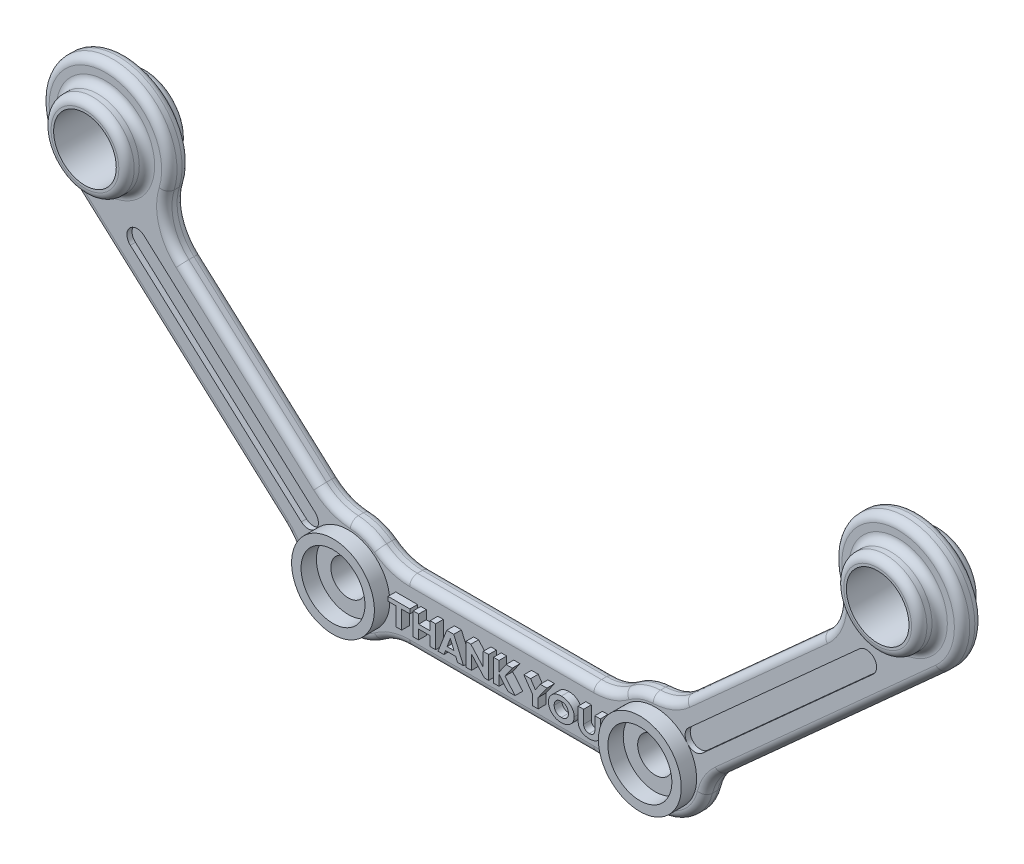
from build123d import *

# Parameters (mm, degrees)
SKETCH1_R                = 6.25
SKETCH1_R_2              = 3.429
BOSS_EXTRUDE1_DEPTH      = 2
BOSS_EXTRUDE5_DEPTH      = 4
BOSS_EXTRUDE5_DEPTH_BACK = 8
SKETCH7_R                = 8.125
SKETCH7_R_2              = 6.125
THANK_YOU_DEPTH          = 1.5
BOSS_EXTRUDE7_DEPTH      = 1.5
CUT_EXTRUDE3_DEPTH       = 1
FILLET1_R                = 10
FILLET2_R                = 1.5
SKETCH15_R               = 8.1
SKETCH15_R_2             = 6.25
BOSS_EXTRUDE8_DEPTH      = 3


with BuildPart() as part:
    # Sketch1 → Boss-Extrude1 (new, symmetric)
    with BuildSketch(Plane.XY):
        with BuildLine():
            Line((85.864132579, -9.289310318), (39.997743892, -50.58759219))
            ThreePointArc((39.997743892, -50.58759219), (33.262858848, -60.252711364), (22, -56.8))
            Line((22, -56.8), (-22, -56.8))
            ThreePointArc((-22, -56.8), (-33.262858848, -60.252711364), (-39.997743892, -50.58759219))
            Line((-39.997743892, -50.58759219), (-85.864132579, -9.289310318))
            ThreePointArc((-85.864132579, -9.289310318), (-77.904361198, 12.493457969), (-68.552689408, -8.729011007))
            Line((-68.552689408, -8.729011007), (-32.563210837, -41.134083065))
            ThreePointArc((-32.563210837, -41.134083065), (-26.721371347, -41.35274674), (-22, -44.8))
            Line((-22, -44.8), (22, -44.8))
            ThreePointArc((22, -44.8), (26.721371347, -41.35274674), (32.563210837, -41.134083065))
            Line((32.563210837, -41.134083065), (68.552689408, -8.729011007))
            ThreePointArc((68.552689408, -8.729011007), (77.904361198, 12.493457969), (85.864132579, -9.289310318))
        make_face()
        with Locations((-77.5, 0)):
            Circle(SKETCH1_R, mode=Mode.SUBTRACT)
        with Locations((77.5, 0)):
            Circle(SKETCH1_R, mode=Mode.SUBTRACT)
        with Locations((30, -50.8)):
            Circle(SKETCH1_R_2, mode=Mode.SUBTRACT)
        with Locations((-30, -50.8)):
            Circle(SKETCH1_R_2, mode=Mode.SUBTRACT)
    extrude(amount=BOSS_EXTRUDE1_DEPTH, both=True)

    # Sketch7 → Boss-Extrude5 (add, two sides: drawn at the far end of the back side and taken through both)
    # profile 1 of 2: a face of its own
    with BuildSketch(Plane.XY.offset(2).offset(-BOSS_EXTRUDE5_DEPTH_BACK)):
        with Locations((-77.5, 0)):
            Circle(SKETCH7_R)
        with Locations((-77.5, 0)):
            Circle(SKETCH7_R_2, mode=Mode.SUBTRACT)
    # profile 2 of 2: a face of its own
    with BuildSketch(Plane.XY.offset(2).offset(-BOSS_EXTRUDE5_DEPTH_BACK)):
        with Locations((77.5, 0)):
            Circle(SKETCH7_R)
        with Locations(Location((77.5, 0, 0), (0, 0, 180))):
            Circle(SKETCH7_R_2, mode=Mode.SUBTRACT)
    extrude(amount=BOSS_EXTRUDE5_DEPTH + BOSS_EXTRUDE5_DEPTH_BACK)

    # Sketch3 → Thank You (add)
    # profile 1 of 8: a face of its own
    with BuildSketch(Plane.XY.offset(2)):
        Polygon((-16.472466218, -48.577487684), (-16.472466218, -49.40752292), (-18.073248458, -49.40752292), (-18.073248458, -52.964816786), (-19.140436618, -52.964816786), (-19.140436618, -49.40752292), (-20.741218858, -49.40752292), (-20.741218858, -48.577487684), align=None)
    # profile 2 of 8: a face of its own
    with BuildSketch(Plane.XY.offset(2)):
        Polygon((-11.432966575, -48.577487684), (-11.432966575, -52.964816786), (-12.500154735, -52.964816786), (-12.500154735, -51.126881622), (-14.753107516, -51.126881622), (-14.753107516, -52.964816786), (-15.820295676, -52.964816786), (-15.820295676, -48.577487684), (-14.753107516, -48.577487684), (-14.753107516, -50.296846386), (-12.500154735, -50.296846386), (-12.500154735, -48.577487684), align=None)
    # profile 3 of 8: a face of its own
    with BuildSketch(Plane.XY.offset(2)):
        Polygon((-7.890494766, -48.577487684), (-5.978449313, -52.964816786), (-7.149391878, -52.964816786), (-7.498636614, -52.134781551), (-9.496835278, -52.134781551), (-9.807172112, -52.964816786), (-10.958660726, -52.964816786), (-9.255976839, -48.577487684), align=None)
        Polygon((-7.848807729, -51.304746315), (-8.557487366, -49.621516379), (-9.186498443, -51.304746315), align=None, mode=Mode.SUBTRACT)
    # profile 4 of 8: a face of its own
    with BuildSketch(Plane.XY.offset(2)):
        Polygon((-1.057526132, -48.577487684), (-1.057526132, -52.964816786), (-1.902383425, -52.964816786), (-4.436955305, -50.15418408), (-4.436955305, -52.964816786), (-5.504143464, -52.964816786), (-5.504143464, -48.577487684), (-4.544415223, -48.577487684), (-2.124714292, -51.259353763), (-2.124714292, -48.577487684), align=None)
    # profile 5 of 8: a face of its own
    with BuildSketch(Plane.XY.offset(2)):
        Polygon((3.566955894, -48.577487684), (2.126437154, -50.649796637), (4.100549974, -52.964816786), (2.705423786, -52.964816786), (0.958273726, -50.916593677), (0.958273726, -52.964816786), (-0.108914434, -52.964816786), (-0.108914434, -48.577487684), (0.958273726, -48.577487684), (0.958273726, -50.563643426), (2.339504235, -48.577487684), align=None)
    # profile 6 of 8: a face of its own
    with BuildSketch(Plane.XY.offset(2)):
        Polygon((7.539267378, -52.964816786), (7.539267378, -51.062961498), (5.819908676, -48.577487684), (7.141850954, -48.577487684), (8.072861458, -50.000405231), (9.02517867, -48.577487684), (10.32581424, -48.577487684), (8.606455538, -51.038875654), (8.606455538, -52.964816786), align=None)
    # profile 7 of 8: a face of its own
    with BuildSketch(Plane.XY.offset(2)):
        with BuildLine():
            add(Edge.make_bspline(
                [(13.144784353, -48.518199453), (13.236294357, -48.519894148), (13.415594504, -48.523214648), (13.677423582, -48.556921101), (13.926308985, -48.608997867), (14.161870705, -48.683400223), (14.384378601, -48.778812525), (14.592748838, -48.896341645), (14.78824804, -49.034179586), (14.966606287, -49.193064558), (15.128901299, -49.364260074), (15.271744927, -49.544210791), (15.391607319, -49.732294879), (15.490803594, -49.926524449), (15.567176994, -50.128226102), (15.622109885, -50.336772476), (15.655256716, -50.552700603), (15.659574731, -50.699088766), (15.661755039, -50.773004992)],
                knots=[0, 0, 0, 0, 1.165622065, 2.283861866, 3.358235241, 4.402427472, 5.426561762, 6.437930106, 7.445716825, 8.468935895, 9.47662273, 10.448902879, 11.392078326, 12.314266974, 13.223459075, 14.135007119, 15.058303401, 16, 16, 16, 16], degree=3))
            add(Edge.make_bspline(
                [(15.661755039, -50.773004992), (15.659688598, -50.847862328), (15.655603002, -50.995864098), (15.620979108, -51.213474018), (15.566269714, -51.423729699), (15.489409584, -51.626678515), (15.388051887, -51.82103416), (15.265986918, -52.008010374), (15.122361617, -52.187896851), (14.957798295, -52.357343507), (14.776509848, -52.513743735), (14.580073699, -52.650169186), (14.372033041, -52.767002245), (14.150546453, -52.860640169), (13.91692309, -52.934003503), (13.670708813, -52.986484972), (13.411825933, -53.01878621), (13.235047795, -53.022307193), (13.144784353, -53.024105017)],
                knots=[0, 0, 0, 0, 0.954451227, 1.887062486, 2.803341652, 3.722216646, 4.648927594, 5.594017305, 6.566642212, 7.580671446, 8.603112717, 9.616100853, 10.626566014, 11.641390661, 12.67793981, 13.745695611, 14.848945495, 16, 16, 16, 16], degree=3))
            add(Edge.make_bspline(
                [(13.144784353, -53.024105017), (13.053589102, -53.022346018), (12.87526039, -53.018906366), (12.614367062, -52.986175421), (12.366089885, -52.935154786), (12.130884686, -52.861821593), (11.908864956, -52.767521961), (11.699342052, -52.65372158), (11.503513406, -52.517071514), (11.322807622, -52.361378704), (11.158614075, -52.192165324), (11.015283911, -52.012841249), (10.89359653, -51.825718532), (10.795113913, -51.630098376), (10.717783977, -51.427082901), (10.661560049, -51.216467641), (10.628738295, -50.997298424), (10.624436308, -50.848459562), (10.622255395, -50.773004992)],
                knots=[0, 0, 0, 0, 1.159962874, 2.26826159, 3.340224557, 4.381686788, 5.397595826, 6.405180259, 7.410171676, 8.430062382, 9.43600586, 10.406204473, 11.346796863, 12.271120889, 13.187703674, 14.106498895, 15.040080603, 16, 16, 16, 16], degree=3))
            add(Edge.make_bspline(
                [(10.622255395, -50.773004992), (10.624424696, -50.698779902), (10.62871207, -50.552082515), (10.661872575, -50.335836413), (10.717012556, -50.127055755), (10.79302972, -49.924927287), (10.892283606, -49.730162587), (11.013314581, -49.54262752), (11.156038728, -49.362443023), (11.318086906, -49.190888544), (11.497981223, -49.033306852), (11.693847851, -48.895585823), (11.902432415, -48.777964384), (12.12498903, -48.682025346), (12.36161783, -48.609314735), (12.61089824, -48.5569203), (12.873360103, -48.523185767), (13.052966756, -48.519886227), (13.144784353, -48.518199453)],
                knots=[0, 0, 0, 0, 0.944229995, 1.866162393, 2.776363907, 3.6878876, 4.608714001, 5.552616899, 6.523460805, 7.529659095, 8.5517293, 9.561236656, 10.571111016, 11.593732465, 12.638955724, 13.71558515, 14.832173099, 16, 16, 16, 16], degree=3))
        make_face()
        with BuildLine():
            add(Edge.make_bspline(
                [(13.144784353, -52.134781551), (13.195787595, -52.133828025), (13.295642992, -52.131961189), (13.44138786, -52.114035696), (13.579471885, -52.084586035), (13.709701605, -52.042668535), (13.832530612, -51.989621008), (13.948523226, -51.925968057), (14.055204743, -51.848052857), (14.154103609, -51.760215816), (14.244279155, -51.663370832), (14.321919277, -51.557309949), (14.388712905, -51.444316115), (14.442080308, -51.323511552), (14.484246109, -51.195704858), (14.513213483, -51.060584065), (14.532803524, -50.918401811), (14.534441816, -50.820936884), (14.535278648, -50.771152235)],
                knots=[0, 0, 0, 0, 1.115777621, 2.184496794, 3.207765851, 4.201533405, 5.17318039, 6.132148444, 7.090568687, 8.057527786, 9.023541851, 9.980483822, 10.928555928, 11.890543238, 12.865029621, 13.868492252, 14.91123537, 16, 16, 16, 16], degree=3))
            add(Edge.make_bspline(
                [(14.535278648, -50.771152235), (14.53446145, -50.721056496), (14.532866421, -50.623278293), (14.513091951, -50.480511746), (14.484396434, -50.345023547), (14.442077066, -50.21693471), (14.388672536, -50.096166774), (14.322208116, -49.983238182), (14.24396708, -49.877920246), (14.154091147, -49.781210622), (14.055532059, -49.69315728), (13.947948748, -49.616616905), (13.832830213, -49.551580715), (13.709832611, -49.498531193), (13.579294179, -49.457990206), (13.441412244, -49.428186274), (13.295636467, -49.410365359), (13.195785389, -49.40848391), (13.144784353, -49.40752292)],
                knots=[0, 0, 0, 0, 1.095159192, 2.137560986, 3.147293072, 4.121460472, 5.083132892, 6.030894661, 6.982093191, 7.947791046, 8.914433627, 9.868602264, 10.830559385, 11.801888316, 12.79328416, 13.816218266, 14.884587611, 16, 16, 16, 16], degree=3))
            add(Edge.make_bspline(
                [(13.144784353, -49.40752292), (13.093783149, -49.408491946), (12.993625071, -49.410394956), (12.84724917, -49.428222803), (12.708681105, -49.457808847), (12.577678372, -49.498772334), (12.454136616, -49.551291821), (12.33871232, -49.616893288), (12.230368458, -49.693132074), (12.130891851, -49.780922492), (12.040993699, -49.877949567), (11.962741977, -49.983236935), (11.896187232, -50.096142707), (11.843122069, -50.217123754), (11.799320424, -50.34482398), (11.771006266, -50.480540908), (11.751120461, -50.623270468), (11.749541005, -50.721053845), (11.748731786, -50.771152235)],
                knots=[0, 0, 0, 0, 1.113170971, 2.186086936, 3.213556208, 4.202959844, 5.178530162, 6.138554233, 7.096302912, 8.066055017, 9.029812305, 9.979099404, 10.924956649, 11.884696591, 12.859031405, 13.866734437, 14.907041527, 16, 16, 16, 16], degree=3))
            add(Edge.make_bspline(
                [(11.748731786, -50.771152235), (11.749560709, -50.820939512), (11.751183518, -50.918409582), (11.770884535, -51.060554971), (11.799473201, -51.19590363), (11.843119085, -51.323322409), (11.89614681, -51.444340199), (11.963030977, -51.557311158), (12.040681685, -51.663341347), (12.130880055, -51.760503731), (12.230695369, -51.84807493), (12.338139132, -51.925693806), (12.454437208, -51.989907487), (12.577810163, -52.042425278), (12.708502782, -52.084769389), (12.847273778, -52.113998447), (12.993618534, -52.131931622), (13.093780944, -52.133819983), (13.144784353, -52.134781551)],
                knots=[0, 0, 0, 0, 1.086577571, 2.127226078, 3.128673001, 4.10332758, 5.063382497, 6.00955016, 6.964569872, 7.928643454, 8.898713819, 9.860685606, 10.817727331, 11.793617821, 12.785389142, 13.813195616, 14.8864637, 16, 16, 16, 16], degree=3))
        make_face(mode=Mode.SUBTRACT)
    # profile 8 of 8: a face of its own
    with BuildSketch(Plane.XY.offset(2)):
        with BuildLine():
            Line((19.693354754, -48.577487684), (20.760542914, -48.577487684))
            Line((20.760542914, -48.577487684), (20.760542914, -51.069446148))
            add(Edge.make_bspline(
                [(20.760542914, -51.069446148), (20.75922476, -51.147351444), (20.756663651, -51.298717602), (20.728783294, -51.518107859), (20.686063278, -51.723029619), (20.625040102, -51.913771453), (20.544650018, -52.08956632), (20.448636108, -52.252062368), (20.333197622, -52.398846689), (20.20099351, -52.530546911), (20.053279988, -52.648318508), (19.888329341, -52.747884484), (19.710470158, -52.834767258), (19.51639304, -52.903952265), (19.30819134, -52.95877327), (19.084483626, -52.995283005), (18.846616684, -53.020825999), (18.682749446, -53.022990519), (18.598375236, -53.024105017)],
                knots=[0, 0, 0, 0, 1.124048165, 2.183970302, 3.186786779, 4.142558732, 5.068176859, 5.971797666, 6.860853538, 7.756034682, 8.660369888, 9.580853754, 10.531842363, 11.513278426, 12.550162722, 13.635501559, 14.782534621, 16, 16, 16, 16], degree=3))
            add(Edge.make_bspline(
                [(18.598375236, -53.024105017), (18.514930441, -53.022961408), (18.352610154, -53.020736813), (18.116500367, -52.995468429), (17.894066369, -52.957832961), (17.686235716, -52.901876922), (17.492350565, -52.831869778), (17.312915276, -52.745411472), (17.148540244, -52.642184162), (16.998542108, -52.524187049), (16.864364054, -52.391783863), (16.748929051, -52.243676732), (16.649786761, -52.082825742), (16.570349885, -51.907293964), (16.50804654, -51.71879985), (16.463742683, -51.516756198), (16.437956109, -51.300783175), (16.434353821, -51.152273241), (16.432502043, -51.075930798)],
                knots=[0, 0, 0, 0, 1.207858031, 2.349575711, 3.434661095, 4.471606332, 5.461837986, 6.415796098, 7.350025858, 8.266973576, 9.174441136, 10.072551113, 10.979798307, 11.904238528, 12.855888234, 13.849677442, 14.894613485, 16, 16, 16, 16], degree=3))
            Line((16.432502043, -51.075930798), (16.432502043, -48.577487684))
            Line((16.432502043, -48.577487684), (17.499690203, -48.577487684))
            Line((17.499690203, -48.577487684), (17.499690203, -51.116691457))
            add(Edge.make_bspline(
                [(17.499690203, -51.116691457), (17.500546553, -51.154101623), (17.502229994, -51.227643849), (17.516420796, -51.334943981), (17.539102943, -51.437008453), (17.573227399, -51.53249877), (17.61418198, -51.623379126), (17.667462053, -51.706829372), (17.727151195, -51.786528385), (17.797927343, -51.858175615), (17.875569177, -51.922916683), (17.959530706, -51.979957957), (18.049289058, -52.028016263), (18.144943616, -52.067192648), (18.246287501, -52.098053417), (18.353767215, -52.118637283), (18.466797162, -52.132144427), (18.543986855, -52.133887881), (18.583553178, -52.134781551)],
                knots=[0, 0, 0, 0, 1.071513455, 2.10641899, 3.095885275, 4.061283482, 5.007391847, 5.945272666, 6.892042761, 7.855614675, 8.823078514, 9.785064836, 10.758860075, 11.734863606, 12.742518403, 13.788858874, 14.866600946, 16, 16, 16, 16], degree=3))
            add(Edge.make_bspline(
                [(18.583553178, -52.134781551), (18.624656695, -52.133853669), (18.704912361, -52.132041956), (18.822087271, -52.119046164), (18.932890838, -52.09710932), (19.037162222, -52.065065009), (19.135768151, -52.025973524), (19.227101908, -51.975850943), (19.313019861, -51.918625511), (19.391686845, -51.851558842), (19.463279748, -51.777022884), (19.524720434, -51.693631379), (19.57690036, -51.603201762), (19.619586434, -51.505280422), (19.653015439, -51.399721102), (19.676888348, -51.286808212), (19.690872116, -51.166142647), (19.692510453, -51.083379586), (19.693354754, -51.040728411)],
                knots=[0, 0, 0, 0, 1.116708024, 2.180400969, 3.19895919, 4.181027281, 5.140799512, 6.075601644, 7.006441693, 7.941093197, 8.878790217, 9.80845728, 10.748216618, 11.710040429, 12.70510482, 13.751717791, 14.841368648, 16, 16, 16, 16], degree=3))
            Line((19.693354754, -51.040728411), (19.693354754, -48.577487684))
        make_face()
    extrude(amount=THANK_YOU_DEPTH)

    # Sketch12 → Boss-Extrude7 (add)
    # profile 1 of 6: a face of its own
    with BuildSketch(Plane(origin=(0, 0, -2), x_dir=(-1, 0, 0), z_dir=(0, 0, -1))):
        with BuildLine():
            Line((-11.88986433, -52.07409444), (-11.88986433, -53.322852807))
            add(Edge.make_bspline(
                [(-11.88986433, -53.322852807), (-11.979949246, -53.368358839), (-12.158649266, -53.458628432), (-12.433701097, -53.574879259), (-12.712319561, -53.672455623), (-12.99387304, -53.753156624), (-13.279069099, -53.814925364), (-13.567379828, -53.859161201), (-13.85897757, -53.887630582), (-14.054643297, -53.890719095), (-14.152698484, -53.89226686)],
                knots=[0, 0, 0, 0, 1.027601516, 2.038436848, 3.0383078, 4.032385978, 5.019284488, 6.007829424, 7.001651131, 8, 8, 8, 8], degree=3))
            add(Edge.make_bspline(
                [(-14.152698484, -53.89226686), (-14.277161087, -53.889812005), (-14.520604802, -53.88501041), (-14.875800439, -53.843030303), (-15.212094869, -53.777446384), (-15.528666153, -53.683455836), (-15.825600105, -53.562246137), (-16.102951394, -53.413085614), (-16.360718559, -53.236958109), (-16.597691075, -53.036270703), (-16.808081057, -52.814100698), (-16.995834931, -52.580579221), (-17.151990262, -52.331889939), (-17.27968118, -52.070868838), (-17.381081667, -51.798075675), (-17.450396087, -51.511536485), (-17.495646357, -51.213389734), (-17.500183914, -51.009956844), (-17.502483541, -50.90685739)],
                knots=[0, 0, 0, 0, 1.186709591, 2.321154991, 3.406265677, 4.451152634, 5.46551681, 6.459952828, 7.448938776, 8.437963703, 9.415627225, 10.36314953, 11.291393777, 12.209893438, 13.13050606, 14.061015161, 15.01732567, 16, 16, 16, 16], degree=3))
            add(Edge.make_bspline(
                [(-17.502483541, -50.90685739), (-17.499832466, -50.803747189), (-17.494598785, -50.600189792), (-17.447119856, -50.301315108), (-17.372091045, -50.013700669), (-17.265278869, -49.738061436), (-17.127094896, -49.474957794), (-16.958793351, -49.224161483), (-16.761413225, -48.984678718), (-16.535004569, -48.760168483), (-16.284522886, -48.554604093), (-16.013146115, -48.374721818), (-15.722643327, -48.223305643), (-15.414338892, -48.09810392), (-15.086589721, -48.001597693), (-14.740303731, -47.935112107), (-14.376149922, -47.891288056), (-14.126892087, -47.886724475), (-13.99953722, -47.884392775)],
                knots=[0, 0, 0, 0, 0.956725153, 1.888741182, 2.802006662, 3.712050624, 4.626778859, 5.55548895, 6.51134318, 7.503316817, 8.51107301, 9.51505965, 10.52040612, 11.547528201, 12.599792297, 13.686794521, 14.818099434, 16, 16, 16, 16], degree=3))
            add(Edge.make_bspline(
                [(-13.99953722, -47.884392775), (-13.897804964, -47.886247632), (-13.697774892, -47.889894727), (-13.403521262, -47.912834178), (-13.121218998, -47.954429146), (-12.850470513, -48.008601291), (-12.592250733, -48.082196944), (-12.346519961, -48.171391232), (-12.110859699, -48.274103797), (-11.963305224, -48.357801311), (-11.88986433, -48.399459283)],
                knots=[0, 0, 0, 0, 1.110924415, 2.184344455, 3.22008277, 4.225247906, 5.197280451, 6.148716305, 7.07857806, 8, 8, 8, 8], degree=3))
            Line((-11.88986433, -48.399459283), (-11.88986433, -49.702565196))
            add(Edge.make_bspline(
                [(-11.88986433, -49.702565196), (-11.977049629, -49.652224515), (-12.147486332, -49.553814579), (-12.406767507, -49.424833723), (-12.662460842, -49.315863488), (-12.915191861, -49.22616263), (-13.164524704, -49.156893736), (-13.410456694, -49.107031287), (-13.652892951, -49.076054084), (-13.813762661, -49.072108488), (-13.893312473, -49.070157397)],
                knots=[0, 0, 0, 0, 1.136155566, 2.221046559, 3.266356359, 4.271718975, 5.245877941, 6.184630589, 7.10230276, 8, 8, 8, 8], degree=3))
            add(Edge.make_bspline(
                [(-13.893312473, -49.070157397), (-13.96914946, -49.071274613), (-14.11754496, -49.073460747), (-14.334234352, -49.099510243), (-14.540572506, -49.138263112), (-14.736511523, -49.194128429), (-14.922149106, -49.265238665), (-15.096495568, -49.353922211), (-15.260311524, -49.458136881), (-15.412605675, -49.577218373), (-15.550522567, -49.708671692), (-15.671335259, -49.850031605), (-15.772937256, -50.000159181), (-15.857298328, -50.158764553), (-15.921111275, -50.32703959), (-15.96650686, -50.503962863), (-15.996469066, -50.688860724), (-15.999150664, -50.815335316), (-16.00051502, -50.879683617)],
                knots=[0, 0, 0, 0, 1.169399512, 2.288245231, 3.362099682, 4.405636331, 5.427192275, 6.424303198, 7.418151308, 8.418171504, 9.40208425, 10.352879019, 11.281344491, 12.193434245, 13.11830754, 14.050416279, 15.008082187, 16, 16, 16, 16], degree=3))
            add(Edge.make_bspline(
                [(-16.00051502, -50.879683617), (-15.999054657, -50.944433838), (-15.996185516, -51.071647106), (-15.967559544, -51.258137195), (-15.924183183, -51.436571885), (-15.860221213, -51.605705594), (-15.779566792, -51.765976174), (-15.681359106, -51.917834001), (-15.564320912, -52.060528684), (-15.430124305, -52.192779352), (-15.282738921, -52.313514755), (-15.123795238, -52.418896031), (-14.955302051, -52.508635373), (-14.775940183, -52.57981126), (-14.587286529, -52.637245769), (-14.388405874, -52.677711606), (-14.179200427, -52.701183675), (-14.036652194, -52.704702055), (-13.963717247, -52.706502238)],
                knots=[0, 0, 0, 0, 1.013385314, 1.990974794, 2.948104233, 3.884704041, 4.816162122, 5.753383252, 6.711142404, 7.700590598, 8.699636683, 9.690428723, 10.682709463, 11.683751314, 12.707789741, 13.767546037, 14.857762689, 16, 16, 16, 16], degree=3))
            add(Edge.make_bspline(
                [(-13.963717247, -52.706502238), (-13.890780878, -52.705112277), (-13.745393439, -52.702341604), (-13.530069773, -52.679047723), (-13.318047606, -52.643975696), (-13.14327387, -52.599358162), (-12.997668684, -52.555417541), (-12.876945241, -52.510732462), (-12.742248255, -52.461480179), (-12.59667558, -52.399207855), (-12.436911344, -52.332376518), (-12.265697274, -52.253814985), (-12.081547698, -52.167562229), (-11.955244005, -52.105974586), (-11.88986433, -52.07409444)],
                knots=[0, 0, 0, 0, 1.198575605, 2.38917621, 3.556309809, 4.72827993, 5.351241694, 6.055508087, 6.843650426, 7.708358239, 8.657433834, 9.690260715, 10.804389632, 12, 12, 12, 12], degree=3))
        make_face()
    # profile 2 of 6: a face of its own
    with BuildSketch(Plane(origin=(0, 0, -2), x_dir=(-1, 0, 0), z_dir=(0, 0, -1))):
        with BuildLine():
            add(Edge.make_bspline(
                [(-7.577880689, -47.884392775), (-7.45586735, -47.886652368), (-7.216800487, -47.891079702), (-6.86769505, -47.936021639), (-6.535847846, -48.005457327), (-6.221765552, -48.104660469), (-5.925088358, -48.231876871), (-5.647261375, -48.388582365), (-5.386595772, -48.572366286), (-5.148784776, -48.784212915), (-4.932391427, -49.012473603), (-4.741933256, -49.252407892), (-4.582116734, -49.503186676), (-4.449855035, -49.762159437), (-4.348023834, -50.031094973), (-4.27477998, -50.309156805), (-4.230584205, -50.597060975), (-4.224826852, -50.792245193), (-4.221919774, -50.890800161)],
                knots=[0, 0, 0, 0, 1.165622065, 2.283861866, 3.358235241, 4.402427472, 5.426561762, 6.437930106, 7.445716825, 8.468935895, 9.47662273, 10.448902879, 11.392078326, 12.314266974, 13.223459075, 14.135007119, 15.058303401, 16, 16, 16, 16], degree=3))
            add(Edge.make_bspline(
                [(-4.221919774, -50.890800161), (-4.224675028, -50.990609942), (-4.230122491, -51.187945635), (-4.276287682, -51.478092194), (-4.349233541, -51.758433103), (-4.451713714, -52.029031525), (-4.586857311, -52.288172385), (-4.749610602, -52.537474002), (-4.941111003, -52.777322639), (-5.160528767, -53.003251513), (-5.402246696, -53.211785151), (-5.66416156, -53.393685752), (-5.941549104, -53.549463164), (-6.236864555, -53.67431373), (-6.548362373, -53.772131508), (-6.876648075, -53.8421068), (-7.221825248, -53.885175118), (-7.457529433, -53.889869761), (-7.577880689, -53.89226686)],
                knots=[0, 0, 0, 0, 0.954451227, 1.887062486, 2.803341652, 3.722216646, 4.648927594, 5.594017305, 6.566642212, 7.580671446, 8.603112717, 9.616100853, 10.626566014, 11.641390661, 12.67793981, 13.745695611, 14.848945495, 16, 16, 16, 16], degree=3))
            add(Edge.make_bspline(
                [(-7.577880689, -53.89226686), (-7.699474357, -53.889921529), (-7.937245973, -53.885335325), (-8.285103743, -53.841694066), (-8.616139979, -53.773666553), (-8.929746911, -53.675888962), (-9.225773218, -53.550156119), (-9.505137089, -53.398422278), (-9.766241951, -53.21622219), (-10.007182997, -53.008631776), (-10.226107726, -52.783013936), (-10.417214611, -52.543915169), (-10.579464452, -52.294418213), (-10.710774609, -52.033591339), (-10.81388119, -51.762904039), (-10.888846428, -51.482083692), (-10.932608766, -51.189858069), (-10.938344749, -50.991406253), (-10.941252632, -50.890800161)],
                knots=[0, 0, 0, 0, 1.159962874, 2.26826159, 3.340224557, 4.381686788, 5.397595826, 6.405180259, 7.410171676, 8.430062382, 9.43600586, 10.406204473, 11.346796863, 12.271120889, 13.187703674, 14.106498895, 15.040080603, 16, 16, 16, 16], degree=3))
            add(Edge.make_bspline(
                [(-10.941252632, -50.890800161), (-10.938360231, -50.791833373), (-10.932643732, -50.596236858), (-10.888429726, -50.307908722), (-10.814909752, -50.029534511), (-10.713553533, -49.760029887), (-10.581215018, -49.50034362), (-10.419840385, -49.250296865), (-10.229541523, -49.010050869), (-10.013477285, -48.781311563), (-9.773618195, -48.57120264), (-9.512462692, -48.387574602), (-9.23434994, -48.230746016), (-8.937607786, -48.102827298), (-8.62210272, -48.005879818), (-8.289728839, -47.93602057), (-7.939779689, -47.891041194), (-7.700304151, -47.886641807), (-7.577880689, -47.884392775)],
                knots=[0, 0, 0, 0, 0.944229995, 1.866162393, 2.776363907, 3.6878876, 4.608714001, 5.552616899, 6.523460805, 7.529659095, 8.5517293, 9.561236656, 10.571111016, 11.593732465, 12.638955724, 13.71558515, 14.832173099, 16, 16, 16, 16], degree=3))
        make_face()
        with BuildLine():
            add(Edge.make_bspline(
                [(-7.577880689, -52.706502238), (-7.509876366, -52.705230871), (-7.376735836, -52.702741756), (-7.182409346, -52.678841099), (-6.998297312, -52.639574885), (-6.824657686, -52.583684884), (-6.660885677, -52.512954848), (-6.506228858, -52.428084246), (-6.363986836, -52.324197313), (-6.232121681, -52.207081259), (-6.111887619, -52.077954613), (-6.008367457, -51.936540103), (-5.919309286, -51.785881658), (-5.848152749, -51.624808906), (-5.791931681, -51.454399981), (-5.753308515, -51.274238924), (-5.72718846, -51.084662586), (-5.725004071, -50.95470935), (-5.723888295, -50.888329818)],
                knots=[0, 0, 0, 0, 1.115777621, 2.184496794, 3.207765851, 4.201533405, 5.17318039, 6.132148444, 7.090568687, 8.057527786, 9.023541851, 9.980483822, 10.928555928, 11.890543238, 12.865029621, 13.868492252, 14.91123537, 16, 16, 16, 16], degree=3))
            add(Edge.make_bspline(
                [(-5.723888295, -50.888329818), (-5.724977893, -50.821535499), (-5.727104598, -50.691164561), (-5.753470558, -50.500809165), (-5.791731248, -50.320158233), (-5.848157071, -50.149373117), (-5.919363112, -49.988349203), (-6.007982338, -49.837777746), (-6.112303719, -49.697353832), (-6.232138297, -49.568407666), (-6.363550415, -49.451003211), (-6.506994829, -49.348949377), (-6.660486209, -49.262234457), (-6.824483011, -49.191501761), (-6.998534254, -49.137447113), (-7.182376834, -49.097708537), (-7.376744537, -49.073947316), (-7.509879308, -49.071438717), (-7.577880689, -49.070157397)],
                knots=[0, 0, 0, 0, 1.095159192, 2.137560986, 3.147293072, 4.121460472, 5.083132892, 6.030894661, 6.982093191, 7.947791046, 8.914433627, 9.868602264, 10.830559385, 11.801888316, 12.79328416, 13.816218266, 14.884587611, 16, 16, 16, 16], degree=3))
            add(Edge.make_bspline(
                [(-7.577880689, -49.070157397), (-7.645882294, -49.071449432), (-7.779426398, -49.073986779), (-7.974594266, -49.097757242), (-8.159351686, -49.137205301), (-8.334021997, -49.191823282), (-8.498744338, -49.261849265), (-8.6526434, -49.349317889), (-8.797101883, -49.450969603), (-8.929737359, -49.568023494), (-9.049601561, -49.697392927), (-9.153937191, -49.837776084), (-9.24267685, -49.988317113), (-9.3134304, -50.149625176), (-9.371832595, -50.319892145), (-9.409584804, -50.500848049), (-9.436099212, -50.691154129), (-9.438205152, -50.821531964), (-9.439284111, -50.888329818)],
                knots=[0, 0, 0, 0, 1.113170971, 2.186086936, 3.213556208, 4.202959844, 5.178530162, 6.138554233, 7.096302912, 8.066055017, 9.029812305, 9.979099404, 10.924956649, 11.884696591, 12.859031405, 13.866734437, 14.907041527, 16, 16, 16, 16], degree=3))
            add(Edge.make_bspline(
                [(-9.439284111, -50.888329818), (-9.43817888, -50.954712853), (-9.436015136, -51.084672947), (-9.409747113, -51.274200132), (-9.371628891, -51.454665011), (-9.31343438, -51.624556717), (-9.242730747, -51.78591377), (-9.153551857, -51.936541715), (-9.05001758, -52.0779153), (-8.929753085, -52.207465145), (-8.796666, -52.324226744), (-8.65340765, -52.427718578), (-8.498343549, -52.51333682), (-8.333846275, -52.583360542), (-8.15958945, -52.639819356), (-7.974561456, -52.678791433), (-7.779435113, -52.702702333), (-7.645885234, -52.705220149), (-7.577880689, -52.706502238)],
                knots=[0, 0, 0, 0, 1.086577571, 2.127226078, 3.128673001, 4.10332758, 5.063382497, 6.00955016, 6.964569872, 7.928643454, 8.898713819, 9.860685606, 10.817727331, 11.793617821, 12.785389142, 13.813195616, 14.8864637, 16, 16, 16, 16], degree=3))
        make_face(mode=Mode.SUBTRACT)
    # profile 3 of 6: a face of its own
    with BuildSketch(Plane(origin=(0, 0, -2), x_dir=(-1, 0, 0), z_dir=(0, 0, -1))):
        with BuildLine():
            Line((-3.194257102, -47.96344375), (-0.562106675, -47.96344375))
            add(Edge.make_bspline(
                [(-0.562106675, -47.96344375), (-0.489184435, -47.96529112), (-0.347070082, -47.968891364), (-0.139211487, -47.991485791), (0.056293161, -48.034583785), (0.241856543, -48.09037215), (0.414766818, -48.165288479), (0.577729254, -48.254162065), (0.72682339, -48.362398355), (0.863631248, -48.484633887), (0.986374921, -48.617409709), (1.094463251, -48.757425608), (1.186724894, -48.903460358), (1.260966, -49.056542404), (1.319585171, -49.214868155), (1.360241835, -49.379782126), (1.385570061, -49.550264883), (1.388978628, -49.666245612), (1.390699437, -49.724798282)],
                knots=[0, 0, 0, 0, 1.190132174, 2.319386577, 3.40523487, 4.452936366, 5.476291939, 6.474730707, 7.476013715, 8.475311122, 9.464210014, 10.422367039, 11.358167881, 12.277642745, 13.193773159, 14.107930534, 15.044791992, 16, 16, 16, 16], degree=3))
            add(Edge.make_bspline(
                [(1.390699437, -49.724798282), (1.389004204, -49.785409634), (1.385657109, -49.905081685), (1.360075327, -50.081264367), (1.319870548, -50.251166481), (1.261651629, -50.414111374), (1.184670465, -50.569036435), (1.095147177, -50.71948094), (0.986658722, -50.862015009), (0.862273662, -50.99569152), (0.724791107, -51.119506785), (0.573558715, -51.227209813), (0.409949863, -51.318391679), (0.234057761, -51.391948547), (0.046834722, -51.450513287), (-0.152694592, -51.490713935), (-0.363838883, -51.515787788), (-0.508921906, -51.519062974), (-0.58310459, -51.520737616)],
                knots=[0, 0, 0, 0, 0.972280417, 1.919686484, 2.850687419, 3.770177767, 4.689098299, 5.622720986, 6.575410498, 7.557161982, 8.549130415, 9.539094758, 10.52987444, 11.548330123, 12.593144668, 13.672460418, 14.809901185, 16, 16, 16, 16], degree=3))
            Line((-0.58310459, -51.520737616), (-1.771339555, -51.520737616))
            Line((-1.771339555, -51.520737616), (-1.771339555, -53.813215886))
            Line((-1.771339555, -53.813215886), (-3.194257102, -53.813215886))
            Line((-3.194257102, -53.813215886), (-3.194257102, -47.96344375))
        make_face()
        with BuildLine():
            Line((-1.771339555, -49.070157397), (-1.771339555, -50.414023969))
            Line((-1.771339555, -50.414023969), (-1.062351125, -50.414023969))
            add(Edge.make_bspline(
                [(-1.062351125, -50.414023969), (-1.024033633, -50.41375278), (-0.949763219, -50.413227138), (-0.84191168, -50.403384409), (-0.740985481, -50.392501385), (-0.64788701, -50.373303745), (-0.561988453, -50.350646022), (-0.484387642, -50.320354535), (-0.4126761, -50.287308902), (-0.348762891, -50.248038523), (-0.291956698, -50.20315553), (-0.244215174, -50.152175354), (-0.202202388, -50.097235389), (-0.169121751, -50.036238009), (-0.1427245, -49.969950023), (-0.124779106, -49.898486949), (-0.113143232, -49.8219326), (-0.111908009, -49.769309974), (-0.111269084, -49.742090683)],
                knots=[0, 0, 0, 0, 1.387972485, 2.690293321, 3.922878707, 5.064114641, 6.131981951, 7.137904281, 8.078991541, 8.990027369, 9.849895678, 10.6942178, 11.514871996, 12.349647457, 13.200274499, 14.094164819, 15.01419815, 16, 16, 16, 16], degree=3))
            add(Edge.make_bspline(
                [(-0.111269084, -49.742090683), (-0.11177587, -49.711569949), (-0.112746205, -49.653132412), (-0.125782793, -49.569156182), (-0.145151192, -49.492443072), (-0.172050114, -49.42219748), (-0.208664252, -49.359554002), (-0.252761235, -49.30370059), (-0.306080508, -49.256370409), (-0.366300467, -49.214610496), (-0.436862707, -49.18007768), (-0.517866932, -49.151058172), (-0.609229158, -49.124579202), (-0.712411947, -49.105961184), (-0.826534992, -49.089904092), (-0.951755843, -49.077233754), (-1.088654404, -49.071879247), (-1.183395675, -49.07074758), (-1.232804789, -49.070157397)],
                knots=[0, 0, 0, 0, 0.975124515, 1.867054548, 2.710124648, 3.502308608, 4.263353011, 5.022116102, 5.767858678, 6.534802739, 7.359158718, 8.271458586, 9.284255906, 10.397198786, 11.620554147, 12.969980277, 14.419795423, 16, 16, 16, 16], degree=3))
            Line((-1.232804789, -49.070157397), (-1.771339555, -49.070157397))
        make_face(mode=Mode.SUBTRACT)
    # profile 4 of 6: a face of its own
    with BuildSketch(Plane(origin=(0, 0, -2), x_dir=(-1, 0, 0), z_dir=(0, 0, -1))):
        Polygon((7.714777421, -47.96344375), (7.714777421, -49.070157397), (5.580401102, -49.070157397), (5.580401102, -53.813215886), (4.157483555, -53.813215886), (4.157483555, -49.070157397), (2.023107235, -49.070157397), (2.023107235, -47.96344375), align=None)
    # profile 5 of 6: a face of its own
    with BuildSketch(Plane(origin=(0, 0, -2), x_dir=(-1, 0, 0), z_dir=(0, 0, -1))):
        Polygon((12.853090783, -52.706502238), (12.853090783, -53.813215886), (8.584338144, -53.813215886), (8.584338144, -47.96344375), (12.774039809, -47.96344375), (12.774039809, -49.070157397), (10.00725569, -49.070157397), (10.00725569, -50.255922019), (12.694988834, -50.255922019), (12.694988834, -51.362635667), (10.00725569, -51.362635667), (10.00725569, -52.706502238), align=None)
    # profile 6 of 6: a face of its own
    with BuildSketch(Plane(origin=(0, 0, -2), x_dir=(-1, 0, 0), z_dir=(0, 0, -1))):
        with BuildLine():
            Line((14.038855405, -47.96344375), (16.640126545, -47.96344375))
            add(Edge.make_bspline(
                [(16.640126545, -47.96344375), (16.708962716, -47.96466759), (16.843761227, -47.967064177), (17.041133876, -47.991734916), (17.229130617, -48.028841222), (17.406784323, -48.083857918), (17.574379148, -48.153101644), (17.732375766, -48.237374078), (17.880300463, -48.337916501), (18.015840482, -48.454080105), (18.140582373, -48.57867159), (18.248577156, -48.712506581), (18.338978444, -48.853414579), (18.415598067, -48.999511968), (18.473703114, -49.153461617), (18.51416662, -49.313881242), (18.539719458, -49.480242246), (18.543065474, -49.593365896), (18.544760969, -49.650687994)],
                knots=[0, 0, 0, 0, 1.161672118, 2.27484578, 3.353245851, 4.393322926, 5.409332417, 6.410778144, 7.411475631, 8.422621979, 9.420490412, 10.384564678, 11.319759873, 12.243176746, 13.165022291, 14.090660647, 15.032498193, 16, 16, 16, 16], degree=3))
            add(Edge.make_bspline(
                [(18.544760969, -49.650687994), (18.541737801, -49.729154353), (18.53584086, -49.882209545), (18.487962969, -50.103780522), (18.407874556, -50.309087622), (18.296709041, -50.498871251), (18.15374175, -50.67265342), (17.978244669, -50.828945382), (17.771398069, -50.969368229), (17.617737158, -51.046157913), (17.538096212, -51.085957255)],
                knots=[0, 0, 0, 0, 1.009876832, 1.969849166, 2.90337302, 3.837393746, 4.79066421, 5.78943985, 6.854288307, 8, 8, 8, 8], degree=3))
            add(Edge.make_bspline(
                [(17.538096212, -51.085957255), (17.57821756, -51.105492911), (17.660912586, -51.145758297), (17.777950599, -51.229373357), (17.890952173, -51.334259535), (18.00319032, -51.458377277), (18.109677487, -51.605847368), (18.215789818, -51.772166332), (18.318716653, -51.960015256), (18.448398466, -52.237263612), (18.60777805, -52.59176493), (18.800655366, -53.010007059), (18.990012394, -53.415792636), (19.115334273, -53.68191143), (19.177168768, -53.813215886)],
                knots=[0, 0, 0, 0, 0.495810877, 1.021927095, 1.592580256, 2.208842634, 2.880387276, 3.613590568, 4.402871239, 5.261323182, 7.018057688, 8.727422997, 10.385292767, 12, 12, 12, 12], degree=3))
            Line((19.177168768, -53.813215886), (17.607265815, -53.813215886))
            add(Edge.make_bspline(
                [(17.607265815, -53.813215886), (17.594082934, -53.786457809), (17.565112608, -53.727655018), (17.518011071, -53.631585832), (17.465282626, -53.518803623), (17.404335365, -53.39013386), (17.336969772, -53.245132384), (17.262212886, -53.084030212), (17.182544834, -52.906106133), (17.097282905, -52.717782488), (17.011621944, -52.529462374), (16.924798509, -52.354380931), (16.842833279, -52.195966421), (16.762734216, -52.056095887), (16.685181568, -51.934903257), (16.610899326, -51.831865171), (16.540952784, -51.745442642), (16.452237931, -51.656708846), (16.339491522, -51.570937157), (16.198254174, -51.496199667), (16.050849853, -51.450524283), (15.950383105, -51.444628254), (15.900258828, -51.441686641)],
                knots=[0, 0, 0, 0, 0.584780316, 1.285096665, 2.097476588, 3.025418743, 4.076234314, 5.231897796, 6.507118777, 7.897902369, 9.284698547, 10.56254788, 11.728677686, 12.780887302, 13.721243484, 14.547893165, 15.270281488, 15.898097152, 17.00392264, 18.032841534, 19.018556905, 20, 20, 20, 20], degree=3))
            Line((15.900258828, -51.441686641), (15.461772952, -51.441686641))
            Line((15.461772952, -51.441686641), (15.461772952, -53.813215886))
            Line((15.461772952, -53.813215886), (14.038855405, -53.813215886))
            Line((14.038855405, -53.813215886), (14.038855405, -47.96344375))
        make_face()
        with BuildLine():
            Line((15.461772952, -49.070157397), (15.461772952, -50.334972994))
            Line((15.461772952, -50.334972994), (16.237460642, -50.334972994))
            add(Edge.make_bspline(
                [(16.237460642, -50.334972994), (16.296065924, -50.333347852), (16.408007096, -50.330243688), (16.566642017, -50.299540713), (16.706165858, -50.247287272), (16.826601306, -50.176147461), (16.924489108, -50.083630958), (16.993499291, -49.970572947), (17.036182102, -49.840154081), (17.040522616, -49.747376735), (17.042792448, -49.698859681)],
                knots=[0, 0, 0, 0, 1.21217828, 2.31536565, 3.326871622, 4.282810987, 5.193012746, 6.084710654, 6.998417184, 8, 8, 8, 8], degree=3))
            add(Edge.make_bspline(
                [(17.042792448, -49.698859681), (17.04021254, -49.649622712), (17.035289875, -49.555674768), (16.997369395, -49.423576824), (16.929281124, -49.311753836), (16.834107876, -49.221131805), (16.712050169, -49.152446042), (16.565367736, -49.104038538), (16.39299566, -49.074872637), (16.269699619, -49.071794725), (16.204111012, -49.070157397)],
                knots=[0, 0, 0, 0, 0.98913347, 1.887343128, 2.730517148, 3.591021639, 4.499582254, 5.522992884, 6.682330386, 8, 8, 8, 8], degree=3))
            Line((16.204111012, -49.070157397), (15.461772952, -49.070157397))
        make_face(mode=Mode.SUBTRACT)
    extrude(amount=BOSS_EXTRUDE7_DEPTH)

    # Sketch14 → Cut-Extrude3 (cut)
    with BuildSketch(Plane.XY.offset(2)):
        with BuildLine():
            Line((-69.955231121, -12.848687695), (-36.513713975, -42.959564981))
            ThreePointArc((-36.513713975, -42.959564981), (-36.365685537, -45.784115845), (-39.1902364, -45.932144283))
            Line((-39.1902364, -45.932144283), (-72.631753547, -15.821266997))
            ThreePointArc((-72.631753547, -15.821266997), (-72.779781985, -12.996716133), (-69.955231121, -12.848687695))
        make_face()
        with BuildLine():
            Line((69.955231121, -12.848687695), (36.513713975, -42.959564981))
            ThreePointArc((36.513713975, -42.959564981), (36.365685537, -45.784115845), (39.1902364, -45.932144283))
            Line((39.1902364, -45.932144283), (72.631753547, -15.821266997))
            ThreePointArc((72.631753547, -15.821266997), (72.779781985, -12.996716133), (69.955231121, -12.848687695))
        make_face()
    cut_extrude3 = extrude(amount=-CUT_EXTRUDE3_DEPTH, mode=Mode.SUBTRACT)

    # Mirror1: Cut-Extrude3 across plane
    add(cut_extrude3.mirror(Plane.XY), mode=Mode.SUBTRACT)

    # Fillet1
    fillet1_edges = [part.edges().sort_by_distance(p)[0] for p in [
        (-22, -44.8, 0),
        (22, -44.8, 0),
        (32.563210837, -41.134083065, 0),
        (68.552689408, -8.729011007, 0),
        (39.997743892, -50.58759219, 0),
        (22, -56.8, 0),
        (-22, -56.8, 0),
        (-39.997743892, -50.58759219, 0),
        (-68.552689408, -8.729011007, 0),
        (-32.563210837, -41.134083065, 0),
    ]]
    fillet(fillet1_edges, radius=FILLET1_R)

    # Fillet2
    fillet2_edges = [part.edges().sort_by_distance(p)[0] for p in [
        (64.299801925, -28.705920853, -2),
        (-64.299801925, -28.705920853, 2),
        (-64.299801925, -28.705920853, -2),
        (64.299801925, -28.705920853, 2),
        (-85.625, 0, 2),
        (-85.625, 0, -2),
        (-85.625, 0, -6),
        (-85.625, 0, 6),
        (-33.369254327, -60.21531334, -2),
        (-33.369254327, -60.21531334, 2),
        (0, -56.8, -2),
        (0, -56.8, 2),
        (33.369254327, -60.21531334, -2),
        (33.369254327, -60.21531334, 2),
        (0, -44.8, -2),
        (0, -44.8, 2),
        (26.618341506, -41.389134693, -2),
        (26.618341506, -41.389134693, 2),
        (49.220148834, -26.136108727, -2),
        (49.220148834, -26.136108727, 2),
        (80.837848086, 12.046110167, -2),
        (80.837848086, 12.046110167, 2),
        (-26.618341506, -41.389134693, -2),
        (-26.618341506, -41.389134693, 2),
        (-49.220148834, -26.136108727, -2),
        (-49.220148834, -26.136108727, 2),
        (-80.837848086, 12.046110167, -2),
        (-80.837848086, 12.046110167, 2),
        (-40.843922924, -50.422253793, -2),
        (-40.843922924, -50.422253793, 2),
        (-21.16227766, -57.313167019, -2),
        (-21.16227766, -57.313167019, 2),
        (21.16227766, -57.313167019, -2),
        (21.16227766, -57.313167019, 2),
        (40.843922924, -50.422253793, -2),
        (40.843922924, -50.422253793, 2),
        (21.16227766, -44.286832981, -2),
        (21.16227766, -44.286832981, 2),
        (32.871106859, -40.071651327, -2),
        (32.871106859, -40.071651327, 2),
        (65.622907507, -9.258042703, -2),
        (65.622907507, -9.258042703, 2),
        (-21.16227766, -44.286832981, -2),
        (-21.16227766, -44.286832981, 2),
        (-32.871106859, -40.071651327, -2),
        (-32.871106859, -40.071651327, 2),
        (-65.622907507, -9.258042703, -2),
        (-65.622907507, -9.258042703, 2),
        (69.375, 0, 2),
        (69.375, 0, -2),
        (69.375, 0, -6),
        (69.375, 0, 6),
    ]]
    fillet(fillet2_edges, radius=FILLET2_R)

    # Sketch15 → Boss-Extrude8 (add)
    # profile 1 of 2: a face of its own
    with BuildSketch(Plane.XY.offset(2)):
        with Locations((-30, -50.8)):
            Circle(SKETCH15_R)
        with Locations((-30, -50.8)):
            Circle(SKETCH15_R_2, mode=Mode.SUBTRACT)
    # profile 2 of 2: a face of its own
    with BuildSketch(Plane.XY.offset(2)):
        with Locations(Location((30, -50.8, 0), (0, 0, 180))):
            Circle(SKETCH15_R)
        with Locations(Location((30, -50.8, 0), (0, 0, 180))):
            Circle(SKETCH15_R_2, mode=Mode.SUBTRACT)
    extrude(amount=BOSS_EXTRUDE8_DEPTH)


solid = part.part
